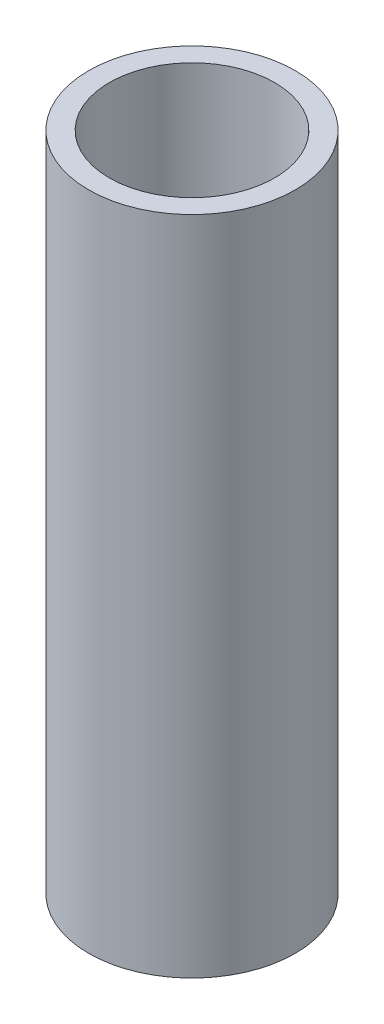
from build123d import *

# Parameters (mm, degrees)
SKETCH1_R           = 1.25
SKETCH1_R_2         = 1
BOSS_EXTRUDE1_DEPTH = 8


with BuildPart() as part:
    # Sketch1 → Boss-Extrude1 (new body)
    with BuildSketch(Plane(origin=(0, 0, 0), x_dir=(1, 0, 0), z_dir=(0, 1, 0))):
        with Locations(Location((0, 0, 0), (0, 0, 270))):
            Circle(SKETCH1_R)
        with Locations(Location((0, 0, 0), (0, 0, 270))):
            Circle(SKETCH1_R_2, mode=Mode.SUBTRACT)
    extrude(amount=BOSS_EXTRUDE1_DEPTH)


solid = part.part
